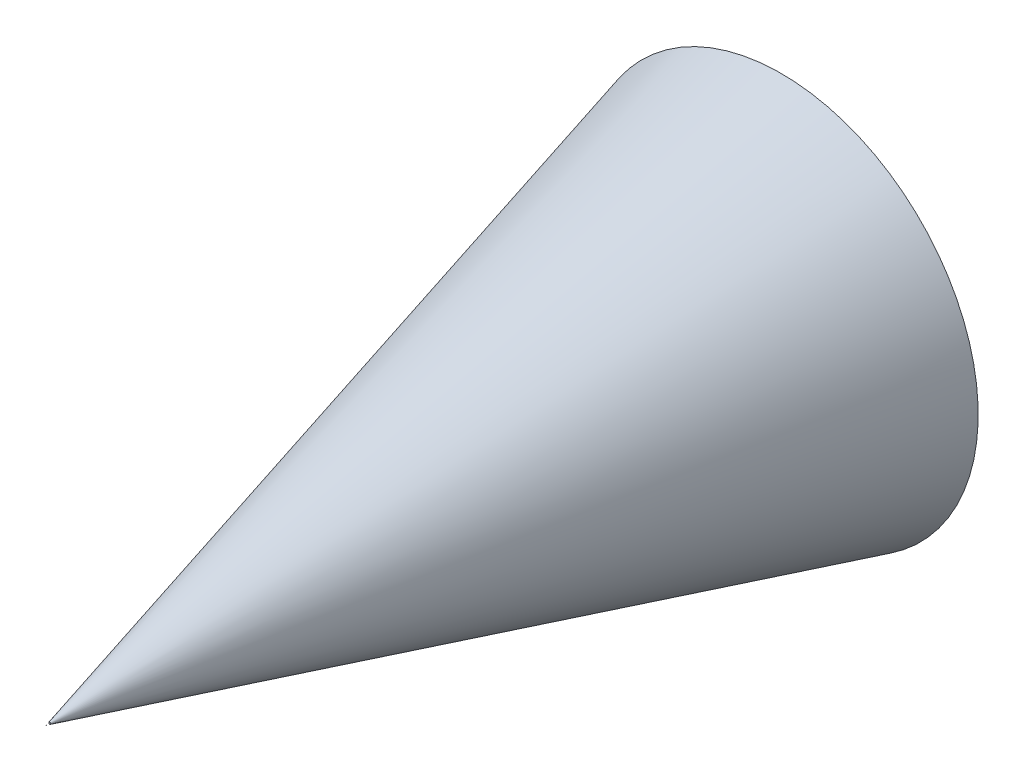
from build123d import *

# Parameters (mm, degrees)
CUT_EXTRUDE1_DEPTH      = 4278.557320619
CUT_EXTRUDE1_DEPTH_BACK = 4278.557320619
SKETCH4_W               = 1
SKETCH4_H               = 1
BOSS_EXTRUDE1_DEPTH     = 1


with BuildPart() as part:
    # Sketch1 → Revolve1 (revolve)
    with BuildSketch(Plane(origin=(0, 0, 0), x_dir=(1, 0, 0), z_dir=(0, 1, 0)), mode=Mode.PRIVATE) as revolve1_sk:
        Polygon((0, 0), (0, 4000), (1071.796769724, 4000), align=None)
    revolve(revolve1_sk.sketch.rotate(Axis((0, 0, 0), (0, 0, -1)), 180), axis=Axis((0, 0, 0), (0, 0, -1)))

    # Sketch2 → Cut-Extrude1 (cut, two sides: drawn at the far end of the back side and taken through both)
    with BuildSketch(Plane(origin=(0, 0, 0), x_dir=(0, 0, -1), z_dir=(1, 0, 0)).offset(-CUT_EXTRUDE1_DEPTH_BACK)):
        Polygon((0, 0), (20, -5.358983849), (20, 5.358983849), align=None)
    extrude(amount=CUT_EXTRUDE1_DEPTH + CUT_EXTRUDE1_DEPTH_BACK, mode=Mode.SUBTRACT)


with BuildPart() as body_2:
    # Sketch4 → Boss-Extrude1 (new body)
    with BuildSketch(Plane.XY):
        Rectangle(SKETCH4_W, SKETCH4_H)
    extrude(amount=-BOSS_EXTRUDE1_DEPTH)


solid = Compound([part.part, body_2.part])
